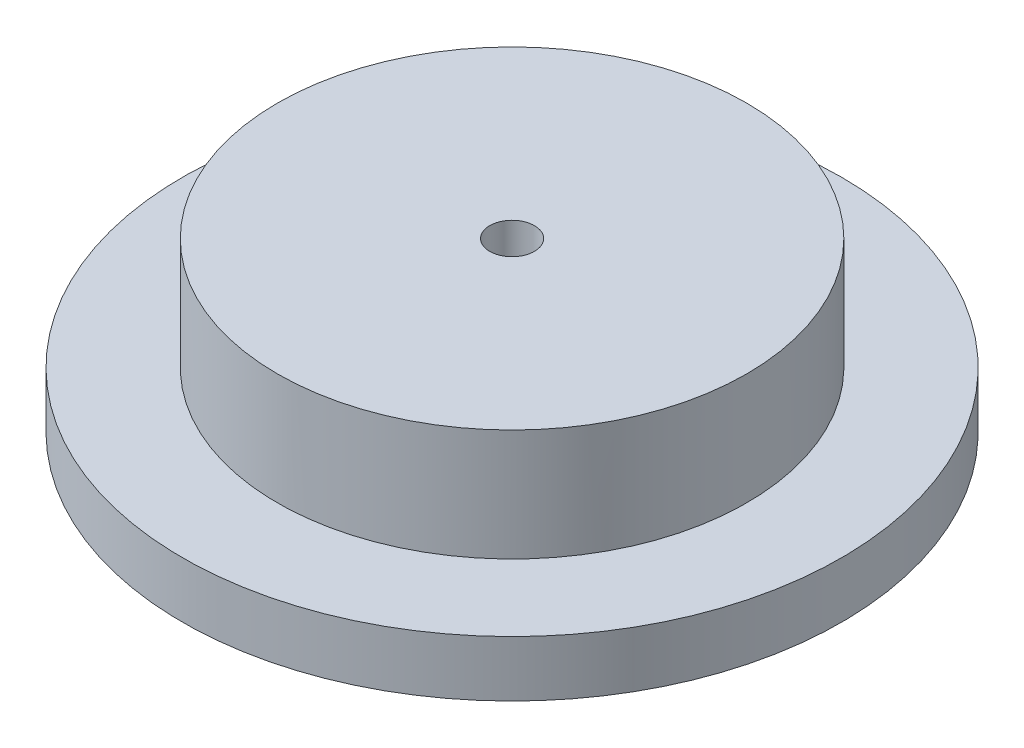
from build123d import *

# Parameters (mm, degrees)
SKETCH1_R           = 2.1
BOSS_EXTRUDE1_DEPTH = 1
SKETCH2_R           = 2.95
BOSS_EXTRUDE2_DEPTH = 0.5
SKETCH3_R           = 0.2
CUT_EXTRUDE1_DEPTH  = 5.43339599


with BuildPart() as part:
    # Sketch1 → Boss-Extrude1 (new body)
    with BuildSketch(Plane(origin=(0, 0, 0), x_dir=(1, 0, 0), z_dir=(0, 1, 0))):
        with Locations(Location((0, 0, 0), (0, 0, 270))):
            Circle(SKETCH1_R)
    extrude(amount=BOSS_EXTRUDE1_DEPTH)

    # Sketch2 → Boss-Extrude2 (add)
    with BuildSketch(Plane.XZ):
        with Locations(Location((0, 0, 0), (0, 0, 270))):
            Circle(SKETCH2_R)
    extrude(amount=BOSS_EXTRUDE2_DEPTH)

    # Sketch3 → Cut-Extrude1 (cut, through all)
    with BuildSketch(Plane(origin=(0, 1, 0), x_dir=(1, 0, 0), z_dir=(0, 1, 0))):
        with Locations(Location((0, 0, 0), (0, 0, 270))):
            Circle(SKETCH3_R)
    extrude(amount=-CUT_EXTRUDE1_DEPTH, mode=Mode.SUBTRACT)


solid = part.part
